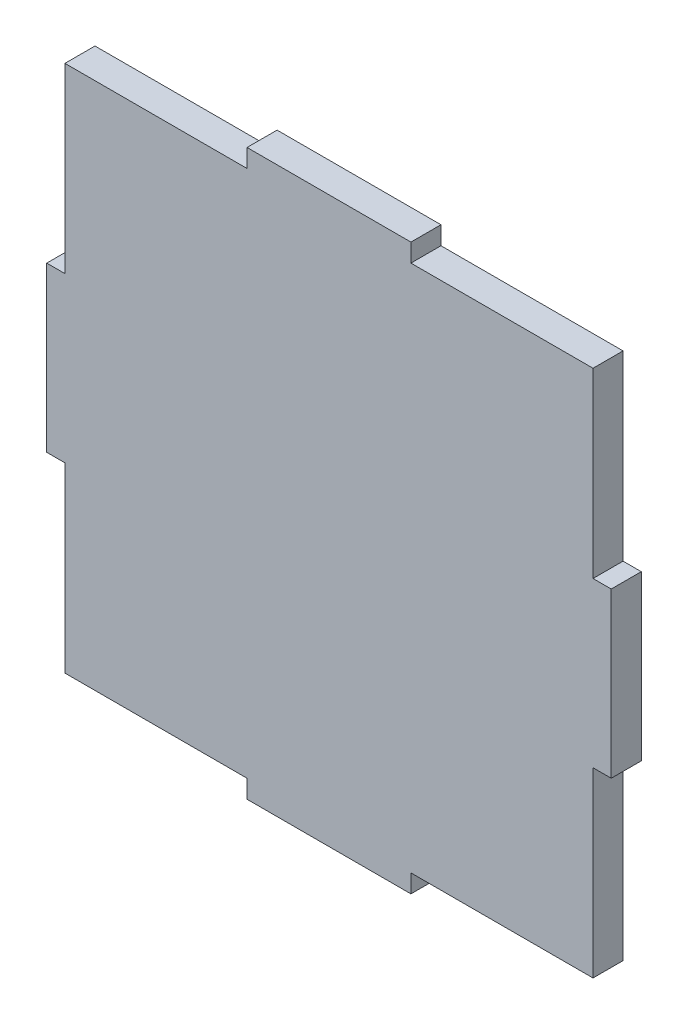
from build123d import *

# Parameters (mm, degrees)
SKETCH1_W           = 29
SKETCH1_H           = 29
SKETCH1_W_2         = 1
SKETCH1_H_2         = 9
SKETCH1_W_3         = 9
SKETCH1_H_3         = 1
BOSS_EXTRUDE1_DEPTH = 1.65


with BuildPart() as part:
    # Sketch1 → Boss-Extrude1 (new body)
    with BuildSketch(Plane.XY):
        with Locations((15.5, 15.5)):
            Rectangle(SKETCH1_W, SKETCH1_H)
        with Locations((0.5, 15.5)):
            Rectangle(SKETCH1_W_2, SKETCH1_H_2)
        with Locations((15.5, 30.5)):
            Rectangle(SKETCH1_W_3, SKETCH1_H_3)
        with Locations((30.5, 15.5)):
            Rectangle(SKETCH1_W_2, SKETCH1_H_2)
        with Locations((15.5, 0.5)):
            Rectangle(SKETCH1_W_3, SKETCH1_H_3)
    extrude(amount=BOSS_EXTRUDE1_DEPTH)


solid = part.part
